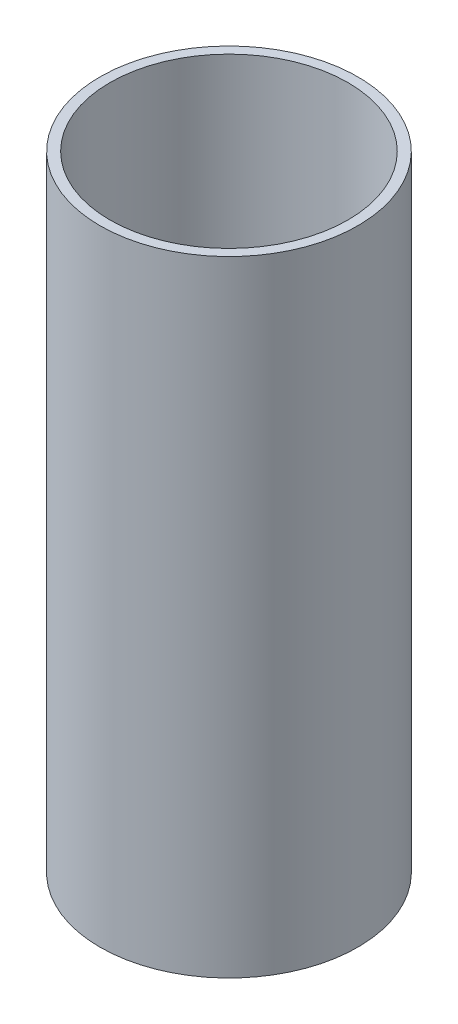
from build123d import *

# Parameters (mm, degrees)
CROQUIS1_R              = 41.275
CROQUIS1_R_2            = 38.1
SALIENTE_EXTRUIR1_DEPTH = 200


with BuildPart() as part:
    # Croquis1 → Saliente-Extruir1 (new body)
    with BuildSketch(Plane(origin=(0, 0, 0), x_dir=(1, 0, 0), z_dir=(0, 1, 0))):
        with Locations(Location((0, 0, 0), (0, 0, 270))):
            Circle(CROQUIS1_R)
        with Locations(Location((0, 0, 0), (0, 0, 270))):
            Circle(CROQUIS1_R_2, mode=Mode.SUBTRACT)
    extrude(amount=SALIENTE_EXTRUIR1_DEPTH)


solid = part.part
